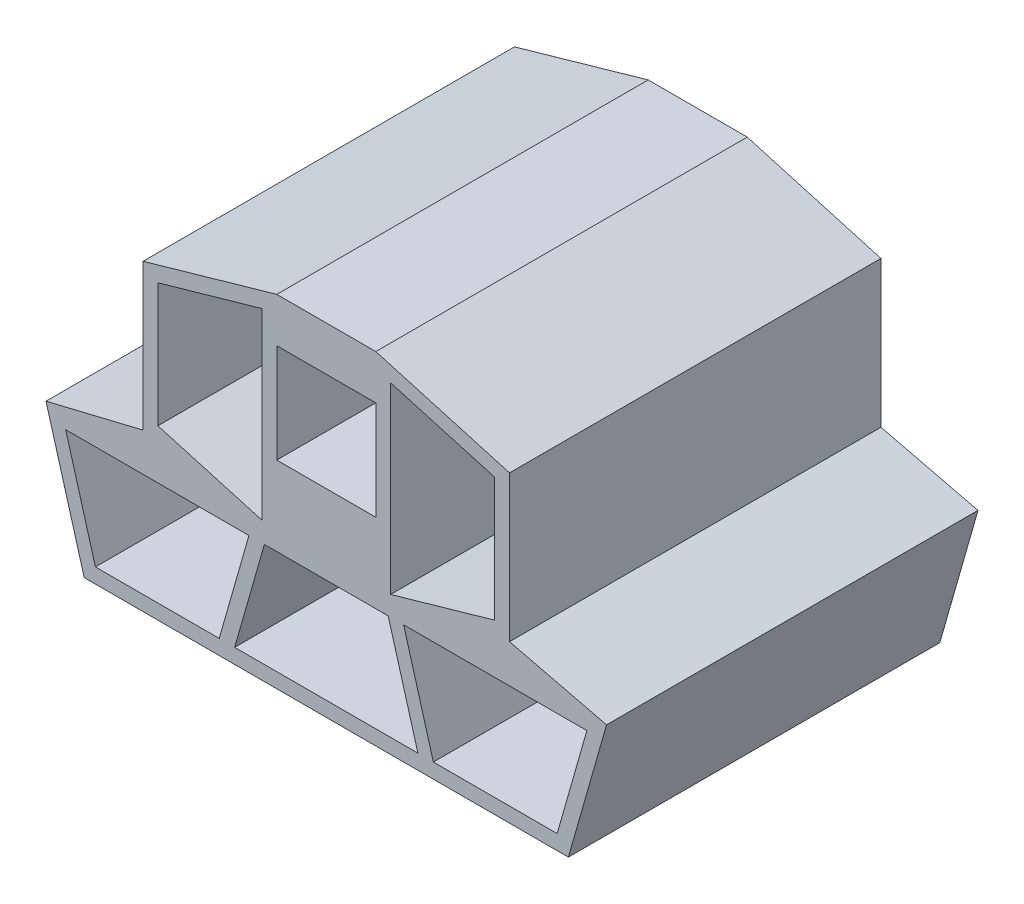
from build123d import *

# Parameters (mm, degrees)
SKETCH1_W           = 20
SKETCH1_H           = 20
BOSS_EXTRUDE1_DEPTH = 75


with BuildPart() as part:
    # Sketch1 → Boss-Extrude1 (new body)
    with BuildSketch(Plane.XY):
        Polygon((56.597237048, -23), (48.882951334, -50), (-48.882951334, -50), (-56.597237048, -23), (-37, -18.262904238), (-37, 11.262904238), (-10, 18.977189953), (0, 18.977189953), (10, 18.977189953), (37, 11.262904238), (37, -18.262904238), align=None)
        Rectangle(SKETCH1_W, SKETCH1_H, mode=Mode.SUBTRACT)
        Polygon((-12.5, -26), (12.5, -26), (18.5, -47), (-18.5, -47), align=None, mode=Mode.SUBTRACT)
        Polygon((15.620047095, -26), (21.620047095, -47), (46.620047095, -47), (52.620047095, -26), align=None, mode=Mode.SUBTRACT)
        Polygon((-15.620047095, -26), (-52.620047095, -26), (-46.620047095, -47), (-21.620047095, -47), align=None, mode=Mode.SUBTRACT)
        Polygon((-13, -22), (-13, 15), (-34, 9), (-34, -16), align=None, mode=Mode.SUBTRACT)
        Polygon((34, 9), (34, -16), (13, -22), (13, 15), align=None, mode=Mode.SUBTRACT)
    extrude(amount=BOSS_EXTRUDE1_DEPTH)


solid = part.part
